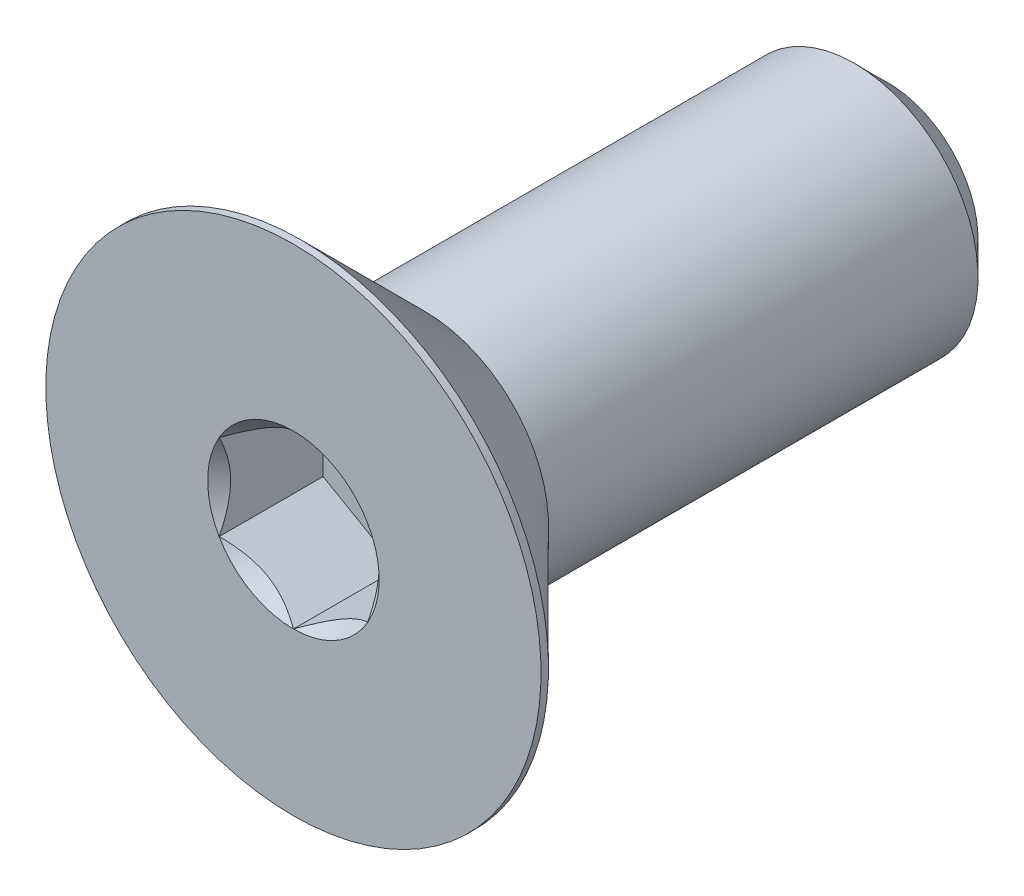
from build123d import *

# Parameters (mm, degrees)
CHAMFER1_SIZE      = 0.3375
CUT_EXTRUDE2_DEPTH = 1.05


with BuildPart() as part:
    # Sketch1 → Revolve1 (revolve)
    with BuildSketch(Plane(origin=(0, 0, 0), x_dir=(0, 0, -1), z_dir=(1, 0, 0))):
        Polygon((-1.5, 1.25), (3, 1.25), (3, 0), (-1.95, 0), (-1.95, 1.25), align=None)
    revolve(axis=Axis((0, 0, 1.95), (0, 0, -1)))

    # Chamfer1
    chamfer1_edges = [part.edges().sort_by_distance(p)[0] for p in [
        (0, -1.25, -3),
    ]]
    chamfer(chamfer1_edges, length=CHAMFER1_SIZE)


with BuildPart() as body_2:
    # Sketch7 → Revolve2 (revolve)
    with BuildSketch(Plane(origin=(0, 0, 0), x_dir=(0, 0, -1), z_dir=(1, 0, 0))):
        Polygon((-2.925, 2.5), (-3, 2.5), (-3, 0), (-1.5, 0), (-1.5, 1.075), align=None)
    revolve(axis=Axis((0, 0, 3), (0, 0, -1)))

    # Sketch5 → Cut-Extrude2 (cut)
    with BuildSketch(Plane.XY.offset(3)):
        Polygon((0.75, -0.433012702), (0.75, 0.433012702), (0, 0.866025404), (-0.75, 0.433012702), (-0.75, -0.433012702), (0, -0.866025404), align=None)
    extrude(amount=-CUT_EXTRUDE2_DEPTH, mode=Mode.SUBTRACT)

    # Cut-Extrude3 cone 1 section (through the dimple's axis) → Cut-Extrude3 (revolve, cut)
    with BuildSketch(Plane(origin=(0, 0, 3), x_dir=(0, -1, 0), z_dir=(1, 0, 0))):
        Polygon((0, 0), (0.866025404, 0), (0, 0.866025404), align=None)
    revolve(axis=Axis((0, 0, 3), (0, 0, -1)), mode=Mode.SUBTRACT)


solid = Compound([part.part, body_2.part])
